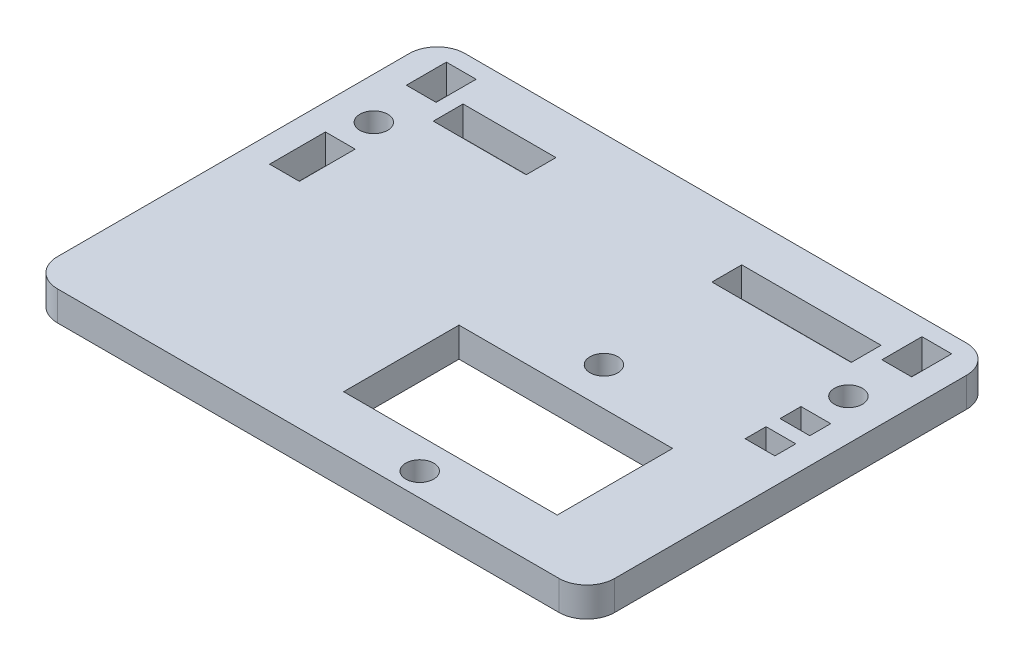
from build123d import *

# Parameters (mm, degrees)
SKETCH1_R           = 1.499947483
SKETCH1_W           = 3.194434014
SKETCH1_H           = 2.247005984
SKETCH1_W_2         = 3.194258538
SKETCH1_H_2         = 6.00021965
SKETCH1_W_3         = 14.9734805
SKETCH1_H_3         = 3.200030878
SKETCH1_W_4         = 9.982157856
SKETCH1_W_5         = 3.194239042
SKETCH1_H_4         = 4.3002681
SKETCH1_H_5         = 2.247064582
SKETCH1_H_6         = 4.300268101
SKETCH1_W_6         = 22.959156093
SKETCH1_H_7         = 12.400537771
BOSS_EXTRUDE1_DEPTH = 3.175


with BuildPart() as part:
    # Sketch1 → Boss-Extrude1 (new body)
    with BuildSketch(Plane(origin=(0, 0, 0), x_dir=(1, 0, 0), z_dir=(0, 1, 0))):
        with BuildLine():
            Line((-8.89863563, 14.616816531), (-8.898772113, -23.184447467))
            ThreePointArc((-8.898772113, -23.184447467), (-8.020049515, -25.305871479), (-5.898625504, -26.184594076))
            Line((-5.898625504, -26.184594076), (48.00009504, -26.184594076))
            ThreePointArc((48.00009504, -26.184594076), (50.117687721, -25.307458468), (50.994823329, -23.189865787))
            Line((50.994823329, -23.189865787), (50.994823329, 14.616811748))
            ThreePointArc((50.994823329, 14.616811748), (50.116118686, 16.738192414), (47.99473802, 17.616897057))
            Line((47.99473802, 17.616897057), (-5.904126705, 17.616897057))
            ThreePointArc((-5.904126705, 17.616897057), (-8.023535046, 16.737855239), (-8.89863563, 14.616816531))
        make_face()
        with Locations(Location((-4.406755257, 6.316598951, 0), (0, 0, 270))):
            Circle(SKETCH1_R, mode=Mode.SUBTRACT)
        with Locations(Location((30.531216432, -3.884174874, 0), (0, 0, 270))):
            Circle(SKETCH1_R, mode=Mode.SUBTRACT)
        with Locations(Location((46.602725133, 6.316403622, 0), (0, 0, 270))):
            Circle(SKETCH1_R, mode=Mode.SUBTRACT)
        with Locations(Location((30.531216431, -23.684709277, 0), (0, 0, 270))):
            Circle(SKETCH1_R, mode=Mode.SUBTRACT)
        with Locations((46.602666641, -2.060335363)):
            Rectangle(SKETCH1_W, SKETCH1_H, mode=Mode.SUBTRACT)
        with Locations((-4.506903026, -0.183533202)):
            Rectangle(SKETCH1_W_2, SKETCH1_H_2, mode=Mode.SUBTRACT)
        with Locations((36.121280984, 11.216808443)):
            Rectangle(SKETCH1_W_3, SKETCH1_H_3, mode=Mode.SUBTRACT)
        with Locations((3.678834136, 11.216808444)):
            Rectangle(SKETCH1_W_4, SKETCH1_H_3, mode=Mode.SUBTRACT)
        with Locations((-4.506717801, 13.66683384)):
            Rectangle(SKETCH1_W_5, SKETCH1_H_4, mode=Mode.SUBTRACT)
        with Locations((46.602666641, 1.692917368)):
            Rectangle(SKETCH1_W, SKETCH1_H_5, mode=Mode.SUBTRACT)
        with Locations((46.602666642, 13.666833838)):
            Rectangle(SKETCH1_W, SKETCH1_H_6, mode=Mode.SUBTRACT)
        with Locations((30.531148191, -14.184180414)):
            Rectangle(SKETCH1_W_6, SKETCH1_H_7, mode=Mode.SUBTRACT)
    extrude(amount=BOSS_EXTRUDE1_DEPTH)


solid = part.part
